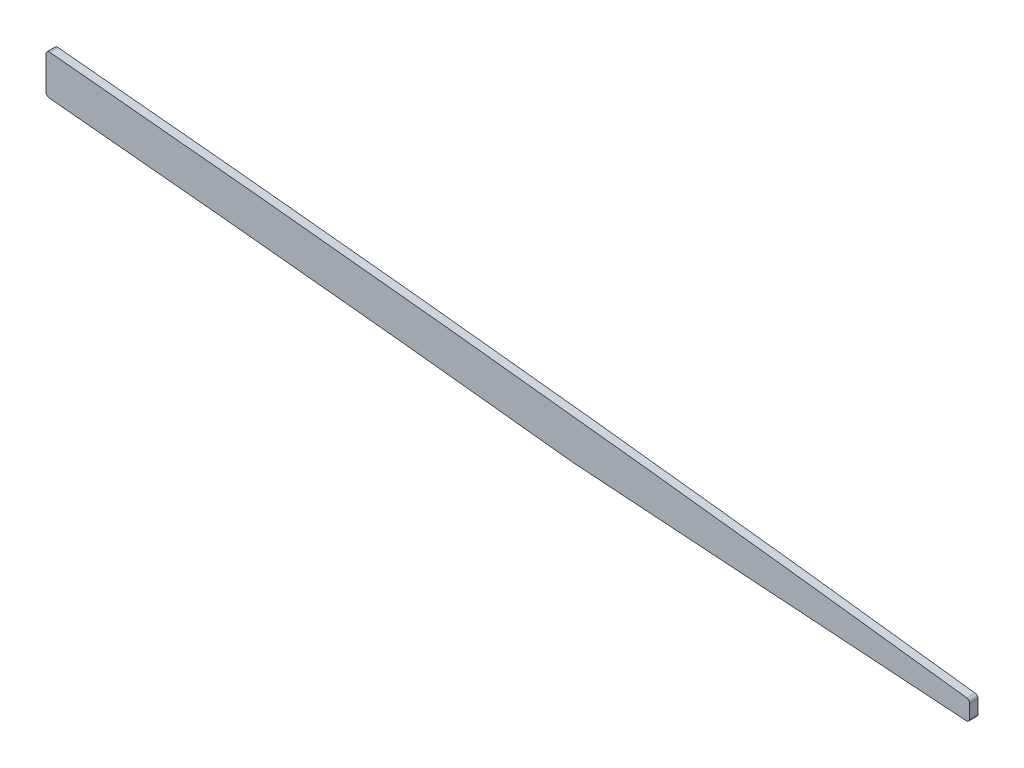
from build123d import *

# Parameters (mm, degrees)
BOSS_EXTRUDE1_DEPTH = 1.5875
FILLET1_R           = 1.27


with BuildPart() as part:
    # Sketch2 → Boss-Extrude1 (new, symmetric)
    with BuildSketch(Plane.XY):
        with BuildLine():
            add(Edge.make_bspline(
                [(2311.4, 135.829939705), (2328.342945407, 134.244574235), (2345.393069943, 132.62356173), (2362.559217098, 130.963943098), (2433.544115673, 123.962494813), (2504.529014249, 116.360848787), (2558.570986897, 110.161821317), (2612.080990815, 103.726427275), (2665.4125, 96.996301665)],
                knots=[225.60075304, 225.60075304, 225.60075304, 225.60075304, 225.60075304, 225.60075304, 233.9431167, 233.9431167, 233.9431167, 260.757015076, 260.757015076, 260.757015076, 260.757015076, 260.757015076, 260.757015076], degree=5))
            Line((2311.4, 135.829939705), (2311.4, 120.523308441))
            add(Edge.make_bspline(
                [(2311.4, 120.523308441), (2313.552310931, 120.321692016), (2325.557433475, 119.19433883), (2347.551509172, 117.100365283), (2377.159899727, 114.21011853), (2406.469653851, 111.26896801), (2435.81832606, 108.240091266), (2469.024707522, 104.715289085), (2494.87246064, 101.880060077), (2510.934244559, 100.080155034), (2513.371052459, 99.806213346)],
                knots=[225.740445061, 225.740445061, 225.740445061, 225.740445061, 226.376989508, 229.287698684, 232.19840786, 235.109117037, 238.019826213, 240.930535389, 244.998118743, 245.725796037, 245.725796037, 245.725796037, 245.725796037], degree=3))
            Line((2513.371052459, 99.806213346), (2665.4125, 89.358331764))
            Line((2665.4125, 89.358331764), (2665.4125, 96.996301665))
        make_face()
    extrude(amount=BOSS_EXTRUDE1_DEPTH, both=True)

    # Fillet1
    fillet1_edges = [part.edges().sort_by_distance(p)[0] for p in [
        (2311.4, 120.523308441, -0.79375),
        (2311.4, 135.829939705, 0.79375),
        (2665.4125, 96.996301665, -0.79375),
        (2665.4125, 89.358331764, 0),
    ]]
    fillet(fillet1_edges, radius=FILLET1_R)


solid = part.part
